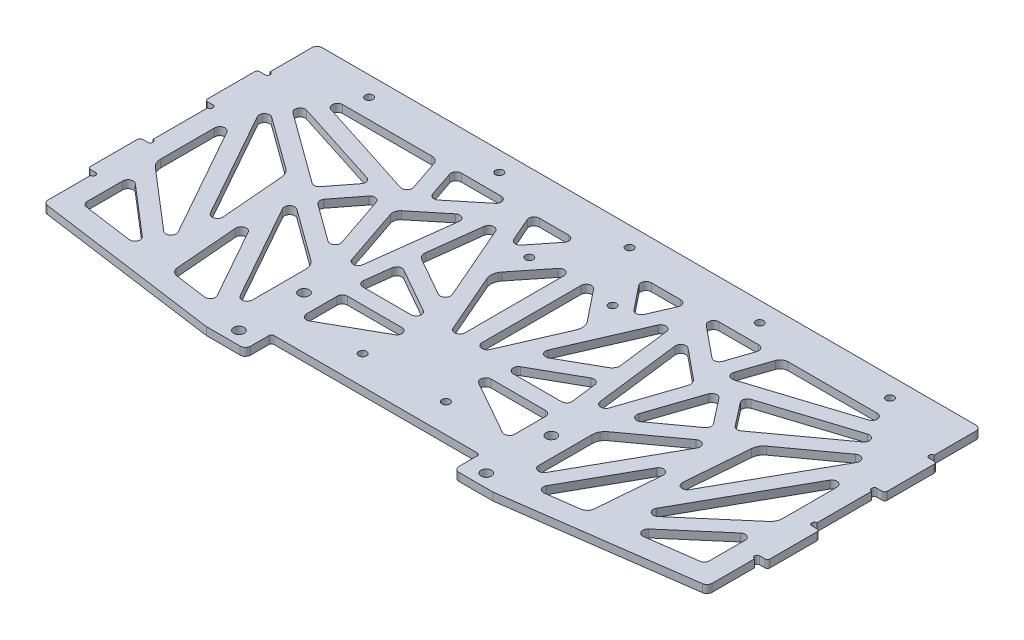
from build123d import *

# Parameters (mm, degrees)
SKETCH_1_R          = 2
SKETCH_1_R_2        = 1.5
EXTRUDE_1_DEPTH     = 3
SKETCH_3_R          = 1
CUT_EXTRUDE_1_DEPTH = 3
CUT_EXTRUDE_2_DEPTH = 168.523878895
FILLET_1_R          = 1
FILLET_3_R          = 5
FILLET_4_R          = 3
FILLET_2_R          = 2


with BuildPart() as part:
    # 草图1 → 凸台-拉伸1 (new body)
    with BuildSketch(Plane(origin=(0, 0, 0), x_dir=(1, 0, 0), z_dir=(0, 1, 0))):
        Polygon((-55, -10), (-127.5, 0), (-127.5, 20), (-130.5, 20), (-130.5, 40), (-127.5, 40), (-127.5, 65), (-130.5, 65), (-130.5, 85), (-127.5, 85), (-127.5, 105), (127.5, 105), (127.5, 85), (130.5, 85), (130.5, 65), (127.5, 65), (127.5, 40), (130.5, 40), (130.5, 20), (127.5, 20), (127.5, 0), (55, -10), (40, -10), (40, 0), (-40, 0), (-40, -10), align=None)
        with Locations(Location((-47.5, 20, 0), (0, 0, 270))):
            Circle(SKETCH_1_R, mode=Mode.SUBTRACT)
        with Locations(Location((-47.5, -5, 0), (0, 0, 270))):
            Circle(SKETCH_1_R, mode=Mode.SUBTRACT)
        with Locations(Location((47.5, 20, 0), (0, 0, 90))):
            Circle(SKETCH_1_R, mode=Mode.SUBTRACT)
        with Locations(Location((47.5, -5, 0), (0, 0, 90))):
            Circle(SKETCH_1_R, mode=Mode.SUBTRACT)
        with Locations(Location((-16, 75, 0), (0, 0, 270))):
            Circle(SKETCH_1_R_2, mode=Mode.SUBTRACT)
        with Locations(Location((-16, 11, 0), (0, 0, 270))):
            Circle(SKETCH_1_R_2, mode=Mode.SUBTRACT)
        with Locations(Location((16, 11, 0), (0, 0, 90))):
            Circle(SKETCH_1_R_2, mode=Mode.SUBTRACT)
        with Locations(Location((16, 75, 0), (0, 0, 90))):
            Circle(SKETCH_1_R_2, mode=Mode.SUBTRACT)
        with Locations(Location((-100, 97.5, 0), (0, 0, 270))):
            Circle(SKETCH_1_R_2, mode=Mode.SUBTRACT)
        with Locations(Location((-50, 97.5, 0), (0, 0, 270))):
            Circle(SKETCH_1_R_2, mode=Mode.SUBTRACT)
        with Locations(Location((0, 97.5, 0), (0, 0, 270))):
            Circle(SKETCH_1_R_2, mode=Mode.SUBTRACT)
        with Locations(Location((50, 97.5, 0), (0, 0, 270))):
            Circle(SKETCH_1_R_2, mode=Mode.SUBTRACT)
        with Locations(Location((100, 97.5, 0), (0, 0, 270))):
            Circle(SKETCH_1_R_2, mode=Mode.SUBTRACT)
    extrude(amount=EXTRUDE_1_DEPTH)

    # 草图3 → 切除-拉伸1 (cut)
    with BuildSketch(Plane(origin=(0, 3, 0), x_dir=(1, 0, 0), z_dir=(0, 1, 0))):
        with Locations((-127.5, 64)):
            Circle(SKETCH_3_R)
        with Locations((-127.5, 86)):
            Circle(SKETCH_3_R)
        with Locations((-127.5, 41)):
            Circle(SKETCH_3_R)
        with Locations((-127.5, 19)):
            Circle(SKETCH_3_R)
        with Locations((127.5, 19)):
            Circle(SKETCH_3_R)
        with Locations((127.5, 41)):
            Circle(SKETCH_3_R)
        with Locations((127.5, 86)):
            Circle(SKETCH_3_R)
        with Locations((127.5, 64)):
            Circle(SKETCH_3_R)
    extrude(amount=-CUT_EXTRUDE_1_DEPTH, mode=Mode.SUBTRACT)

    # 草图4 → 切除-拉伸2 (cut, through all)
    with BuildSketch(Plane(origin=(0, 3, 0), x_dir=(1, 0, 0), z_dir=(0, 1, 0))):
        Polygon((-119.5, 26.742331644), (-119.5, 6.972293058), (-92.065700875, 3.1882518), align=None)
        Polygon((-119.5, 65.314101108), (-119.5, 34.650347078), (-86.328492694, 6.170511377), align=None)
        Polygon((-119.5, 77.579602721), (-87.506342805, 20.53607685), (-90.450968081, 56.449990533), align=None)
        Polygon((-61.286345468, -1.057176532), (-82.871181809, 37.427800745), (-79.926556532, 1.513887063), align=None)
        Polygon((-60.244712959, 72.341966741), (-66.212409602, 90), (-115.441048718, 90), align=None)
        Polygon((-84.049031919, 51.793366218), (-55, 0), (-55, 30.66375403), align=None)
        Polygon((-119.5, 84.998956395), (-80.849039648, 56.885117517), (-71.044853813, 69.49751828), align=None)
        Polygon((-64.958780583, 67.550503464), (-75.994393782, 53.353957348), (-55, 38.083107704), align=None)
        Polygon((-57.657266298, 64.68587731), (-46.602242487, 31.974767847), (-40.833982718, 78.448321244), align=None)
        Polygon((-59.87902238, 90), (-36.189113592, 90), (-54.748025825, 74.817708869), align=None)
        Polygon((-34.104669286, 83.953298818), (-37.739861741, 54.665382284), (-16.047653992, 42.370340378), align=None)
        Polygon((-40, 27.221924224), (-40, 10), (-9.469594315, 27.221924224), align=None)
        Polygon((-38.539618531, 48.221924224), (-40.40140637, 33.221924224), (-12.075038849, 33.221924224), align=None)
        Polygon((-30.189113592, 90), (-11.70853342, 90), (-23.675502257, 75), align=None)
        Polygon((-3.264932022, 81.341913883), (-18.264932022, 62.540160234), (-3.264932022, 27.99711054), align=None)
        Polygon((3.264932022, 27.99711054), (3.264932022, 81.341913883), (18.264932022, 62.540160234), align=None)
        Polygon((23.675502257, 75), (11.70853342, 90), (30.189113592, 90), align=None)
        Polygon((12.075038849, 33.221924224), (38.539618531, 48.221924224), (40.40140637, 33.221924224), align=None)
        Polygon((9.469594315, 27.221924224), (40, 27.221924224), (40, 10), align=None)
        Polygon((16.047653992, 42.370340378), (34.104669286, 83.953298818), (37.739861741, 54.665382284), align=None)
        Polygon((54.748025825, 74.817708869), (59.87902238, 90), (36.189113592, 90), align=None)
        Polygon((46.602242487, 31.974767847), (40.833982718, 78.448321244), (57.657266298, 64.68587731), align=None)
        Polygon((64.958780583, 67.550503464), (55, 38.083107704), (75.994393782, 53.353957348), align=None)
        Polygon((79.926556532, 1.513887063), (61.286345468, -1.057176532), (82.871181809, 37.427800745), align=None)
        Polygon((87.506342805, 20.53607685), (90.450968081, 56.449990533), (119.5, 77.579602721), align=None)
        Polygon((71.044853813, 69.49751828), (80.849039648, 56.885117517), (119.5, 84.998956395), align=None)
        Polygon((115.441048718, 90), (60.244712959, 72.341966741), (66.212409602, 90), align=None)
        Polygon((55, 30.66375403), (84.049031919, 51.793366218), (55, 0), align=None)
        Polygon((86.328492694, 6.170511377), (119.5, 65.314101108), (119.5, 34.650347078), align=None)
        Polygon((92.065700875, 3.1882518), (119.5, 26.742331644), (119.5, 6.972293058), align=None)
    extrude(amount=-CUT_EXTRUDE_2_DEPTH, mode=Mode.SUBTRACT)

    # 圆角1
    fillet_1_edges = [part.edges().sort_by_distance(p)[0] for p in [
        (-40, 1.5, 0),
        (-130.5, 1.5, -20),
        (-130.5, 1.5, -40),
        (-130.5, 1.5, -65),
        (-130.5, 1.5, -85),
        (130.5, 1.5, -85),
        (130.5, 1.5, -65),
        (130.5, 1.5, -40),
        (130.5, 1.5, -20),
        (40, 1.5, 0),
    ]]
    fillet(fillet_1_edges, radius=FILLET_1_R)

    # 圆角3
    fillet_3_edges = [part.edges().sort_by_distance(p)[0] for p in [
        (-18.264932022, 1.5, -62.540160234),
        (18.264932022, 1.5, -62.540160234),
        (-119.5, 1.5, -34.650347078),
        (-90.450968081, 1.5, -56.449990533),
        (-55, 1.5, -30.66375403),
        (119.5, 1.5, -34.650347078),
        (55, 1.5, -30.66375403),
        (90.450968081, 1.5, -56.449990533),
    ]]
    fillet(fillet_3_edges, radius=FILLET_3_R)

    # 圆角4
    fillet_4_edges = [part.edges().sort_by_distance(p)[0] for p in [
        (-37.739861741, 1.5, -54.665382284),
        (-57.657266298, 1.5, -64.68587731),
        (-79.926556532, 1.5, -1.513887063),
        (-66.212409602, 1.5, -90),
        (66.212409602, 1.5, -90),
        (37.739861741, 1.5, -54.665382284),
        (79.926556532, 1.5, -1.513887063),
        (57.657266298, 1.5, -64.68587731),
    ]]
    fillet(fillet_4_edges, radius=FILLET_4_R)

    # 圆角2
    fillet_2_edges = [part.edges().sort_by_distance(p)[0] for p in [
        (-40, 1.5, -27.221924224),
        (-9.469594315, 1.5, -27.221924224),
        (-40, 1.5, -10),
        (-38.539618531, 1.5, -48.221924224),
        (-12.075038849, 1.5, -33.221924224),
        (-40.40140637, 1.5, -33.221924224),
        (-34.104669286, 1.5, -83.953298818),
        (-16.047653992, 1.5, -42.370340378),
        (-64.958780583, 1.5, -67.550503464),
        (-55, 1.5, -38.083107704),
        (-75.994393782, 1.5, -53.353957348),
        (-11.70853342, 1.5, -90),
        (-23.675502257, 1.5, -75),
        (-30.189113592, 1.5, -90),
        (-3.264932022, 1.5, -81.341913883),
        (-3.264932022, 1.5, -27.99711054),
        (30.189113592, 1.5, -90),
        (23.675502257, 1.5, -75),
        (11.70853342, 1.5, -90),
        (3.264932022, 1.5, -27.99711054),
        (3.264932022, 1.5, -81.341913883),
        (-119.5, 1.5, -65.314101108),
        (-86.328492694, 1.5, -6.170511377),
        (-119.5, 1.5, -77.579602721),
        (-87.506342805, 1.5, -20.53607685),
        (-40.833982718, 1.5, -78.448321244),
        (-46.602242487, 1.5, -31.974767847),
        (-54.748025825, 1.5, -74.817708869),
        (-59.87902238, 1.5, -90),
        (-36.189113592, 1.5, -90),
        (-82.871181809, 1.5, -37.427800745),
        (-61.286345468, 1.5, 1.057176532),
        (-60.244712959, 1.5, -72.341966741),
        (-115.441048718, 1.5, -90),
        (-119.5, 1.5, -84.998956395),
        (-71.044853813, 1.5, -69.49751828),
        (-80.849039648, 1.5, -56.885117517),
        (-84.049031919, 1.5, -51.793366218),
        (-55, 1.5, 0),
        (86.328492694, 1.5, -6.170511377),
        (119.5, 1.5, -65.314101108),
        (55, 1.5, 0),
        (84.049031919, 1.5, -51.793366218),
        (71.044853813, 1.5, -69.49751828),
        (119.5, 1.5, -84.998956395),
        (80.849039648, 1.5, -56.885117517),
        (115.441048718, 1.5, -90),
        (60.244712959, 1.5, -72.341966741),
        (119.5, 1.5, -6.972293058),
        (92.065700875, 1.5, -3.1882518),
        (119.5, 1.5, -26.742331644),
        (16.047653992, 1.5, -42.370340378),
        (34.104669286, 1.5, -83.953298818),
        (54.748025825, 1.5, -74.817708869),
        (36.189113592, 1.5, -90),
        (59.87902238, 1.5, -90),
        (40, 1.5, -10),
        (9.469594315, 1.5, -27.221924224),
        (40, 1.5, -27.221924224),
        (40.40140637, 1.5, -33.221924224),
        (12.075038849, 1.5, -33.221924224),
        (38.539618531, 1.5, -48.221924224),
        (-40, 1.5, 10),
        (-127.5, 1.5, 0),
        (119.5, 1.5, -77.579602721),
        (87.506342805, 1.5, -20.53607685),
        (82.871181809, 1.5, -37.427800745),
        (61.286345468, 1.5, 1.057176532),
        (-127.5, 1.5, -105),
        (127.5, 1.5, -105),
        (46.602242487, 1.5, -31.974767847),
        (40.833982718, 1.5, -78.448321244),
        (64.958780583, 1.5, -67.550503464),
        (75.994393782, 1.5, -53.353957348),
        (55, 1.5, -38.083107704),
        (127.5, 1.5, 0),
        (-119.5, 1.5, -26.742331644),
        (-92.065700875, 1.5, -3.1882518),
        (-119.5, 1.5, -6.972293058),
        (40, 1.5, 10),
    ]]
    fillet(fillet_2_edges, radius=FILLET_2_R)


solid = part.part
